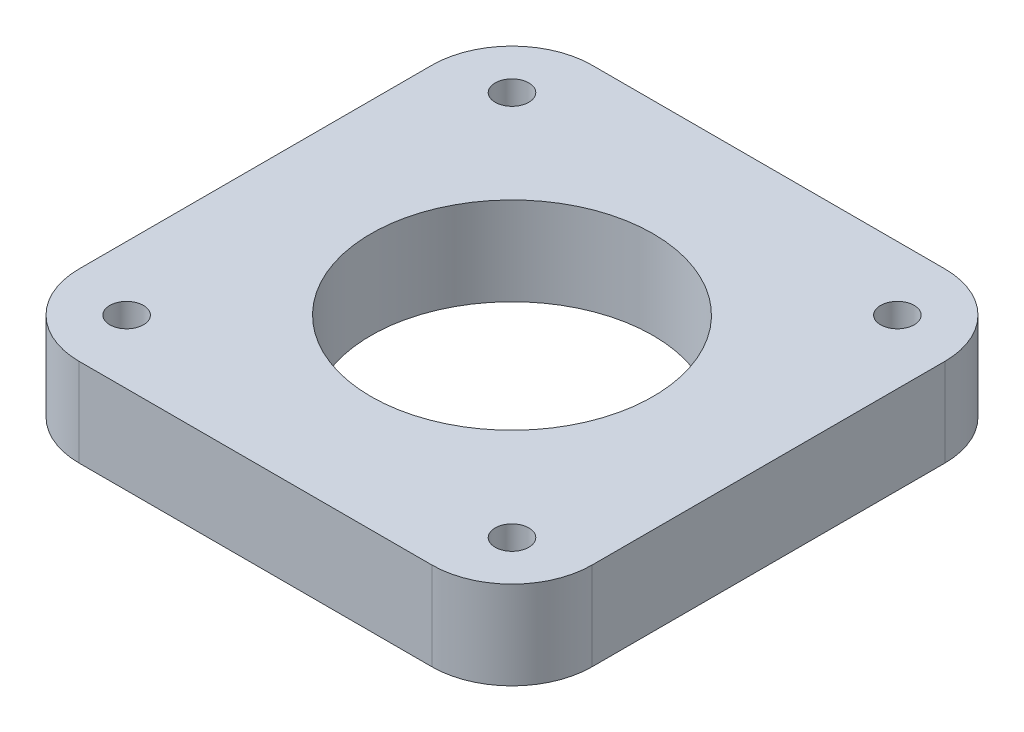
from build123d import *

# Parameters (mm, degrees)
SKETCH_1_W          = 64
SKETCH_1_H          = 64
EXTRUDE_1_DEPTH     = 11
SKETCH_2_R          = 17.6
SKETCH_2_R_2        = 2.1
CUT_EXTRUDE_1_DEPTH = 11
FILLET_1_R          = 10


with BuildPart() as part:
    # 草图1 → 凸台-拉伸1 (new body)
    with BuildSketch(Plane(origin=(0, 0, 0), x_dir=(1, 0, 0), z_dir=(0, 1, 0))):
        Rectangle(SKETCH_1_W, SKETCH_1_H)
    extrude(amount=EXTRUDE_1_DEPTH)

    # 草图2 → 切除-拉伸1 (cut)
    with BuildSketch(Plane(origin=(0, 11, 0), x_dir=(1, 0, 0), z_dir=(0, 1, 0))):
        with Locations(Location((0, 0, 0), (0, 0, 270))):
            Circle(SKETCH_2_R)
        with Locations(Location((24.04163056, 24.04163056, 0), (0, 0, 270))):
            Circle(SKETCH_2_R_2)
        with Locations(Location((24.04163056, -24.04163056, 0), (0, 0, 270))):
            Circle(SKETCH_2_R_2)
        with Locations(Location((-24.04163056, -24.04163056, 0), (0, 0, 270))):
            Circle(SKETCH_2_R_2)
        with Locations(Location((-24.04163056, 24.04163056, 0), (0, 0, 270))):
            Circle(SKETCH_2_R_2)
    extrude(amount=-CUT_EXTRUDE_1_DEPTH, mode=Mode.SUBTRACT)

    # 圆角1
    fillet_1_edges = [part.edges().sort_by_distance(p)[0] for p in [
        (32, 5.5, 32),
        (-32, 5.5, 32),
        (-32, 5.5, -32),
        (32, 5.5, -32),
    ]]
    fillet(fillet_1_edges, radius=FILLET_1_R)


solid = part.part
